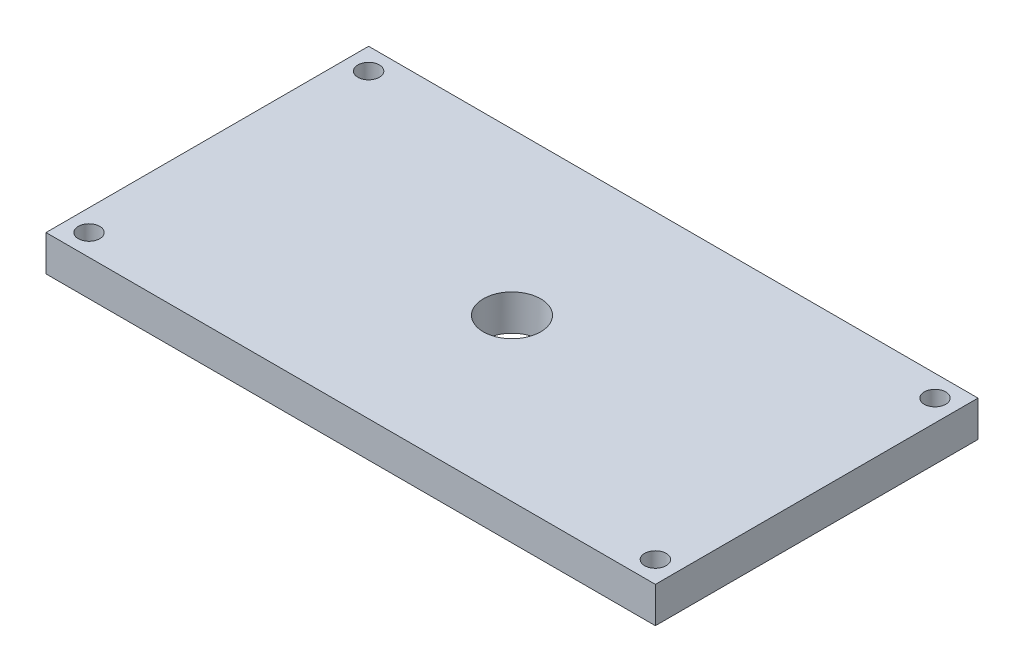
from build123d import *

# Parameters (mm, degrees)
SKETCH1_W           = 85
SKETCH1_H           = 45
BOSS_EXTRUDE1_DEPTH = 5
SKETCH2_R           = 1.5
CUT_EXTRUDE1_DEPTH  = 5
SKETCH3_R           = 4
CUT_EXTRUDE2_DEPTH  = 10


with BuildPart() as part:
    # Sketch1 → Boss-Extrude1 (new body)
    with BuildSketch(Plane(origin=(0, 0, 0), x_dir=(1, 0, 0), z_dir=(0, 1, 0))):
        with Locations((42.5, 22.5)):
            Rectangle(SKETCH1_W, SKETCH1_H)
    extrude(amount=BOSS_EXTRUDE1_DEPTH)

    # Sketch2 → Cut-Extrude1 (cut)
    with BuildSketch(Plane(origin=(0, 5, 0), x_dir=(1, 0, 0), z_dir=(0, 1, 0))):
        with Locations(Location((3, 42, 0), (0, 0, 270))):
            Circle(SKETCH2_R)
        with Locations(Location((3, 3, 0), (0, 0, 270))):
            Circle(SKETCH2_R)
        with Locations(Location((82, 3, 0), (0, 0, 270))):
            Circle(SKETCH2_R)
        with Locations(Location((82, 42, 0), (0, 0, 270))):
            Circle(SKETCH2_R)
    extrude(amount=-CUT_EXTRUDE1_DEPTH, mode=Mode.SUBTRACT)

    # Sketch3 → Cut-Extrude2 (cut)
    with BuildSketch(Plane(origin=(0, 5, 0), x_dir=(1, 0, 0), z_dir=(0, 1, 0))):
        with Locations(Location((42.5, 22.5, 0), (0, 0, 270))):
            Circle(SKETCH3_R)
    extrude(amount=-CUT_EXTRUDE2_DEPTH, mode=Mode.SUBTRACT)


solid = part.part
